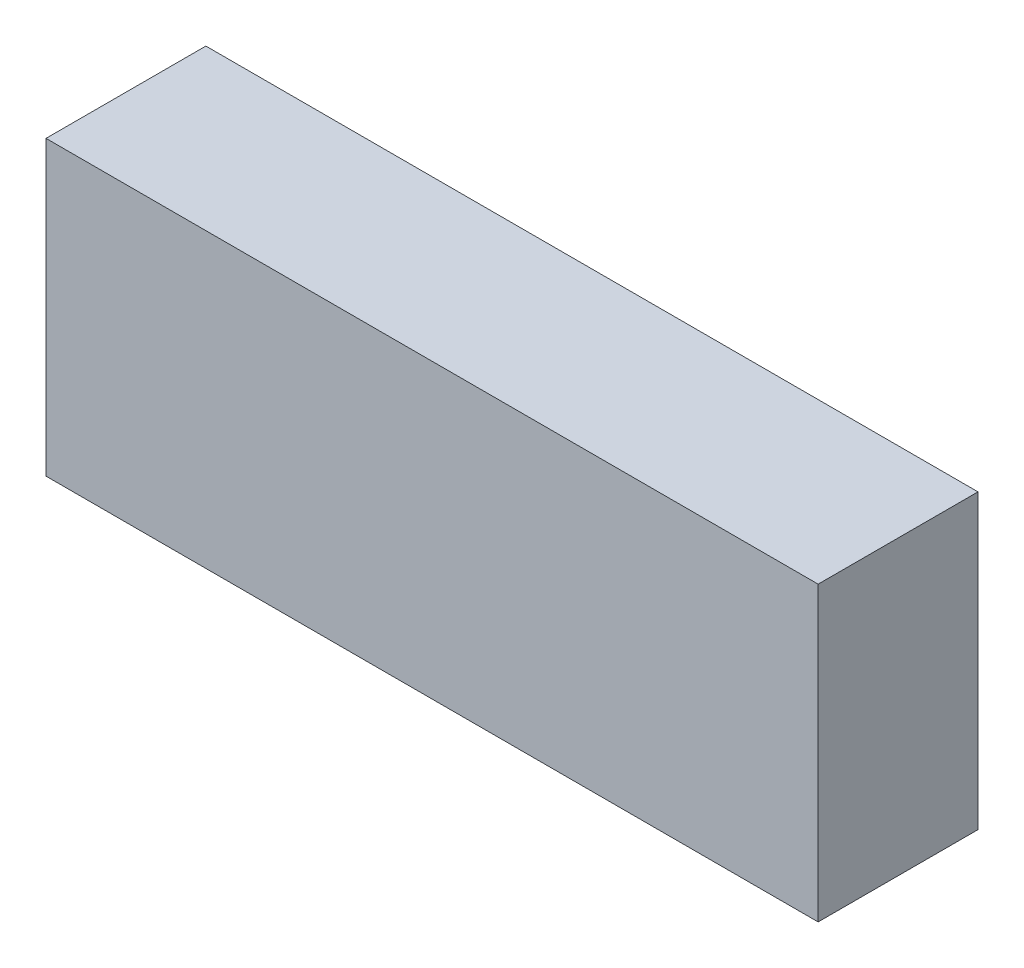
from build123d import *

# Parameters (mm, degrees)
SKETCH_1_W      = 48.3
SKETCH_1_H      = 18.3
EXTRUDE_1_DEPTH = 10


with BuildPart() as part:
    # 草图1 → 凸台-拉伸1 (new body)
    with BuildSketch(Plane.XY):
        with Locations((0, 9.15)):
            Rectangle(SKETCH_1_W, SKETCH_1_H)
    extrude(amount=EXTRUDE_1_DEPTH)


solid = part.part
